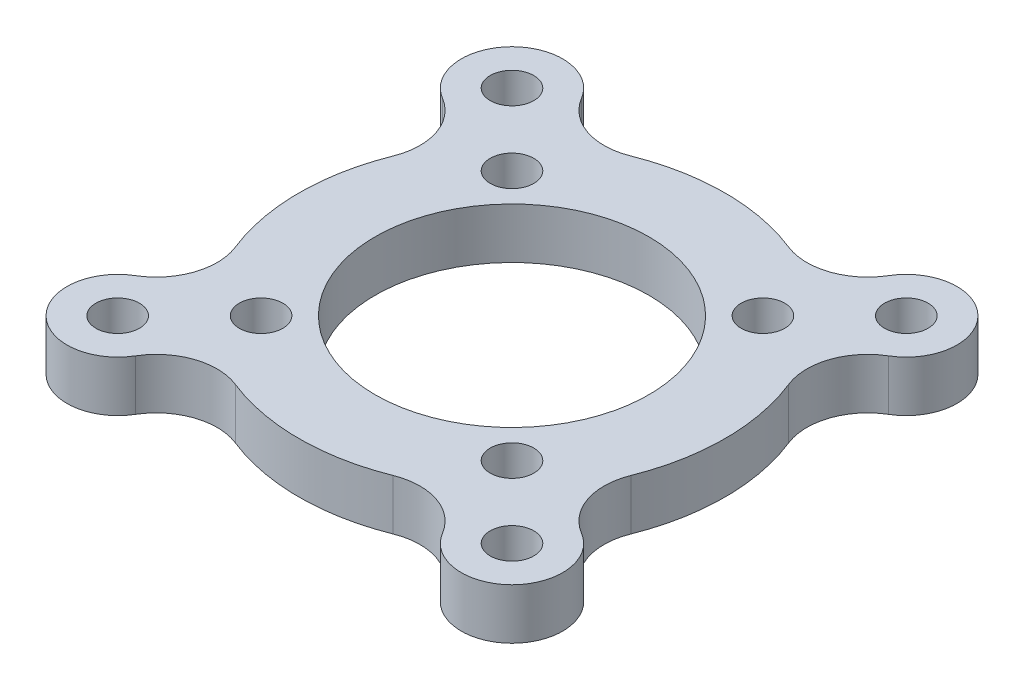
from build123d import *

# Parameters (mm, degrees)
SKETCH_1_R      = 13.5
SKETCH_1_R_2    = 2.15
EXTRUDE_1_DEPTH = 5


with BuildPart() as part:
    # ｽｹｯﾁ1 → ﾎﾞｽ - 押し出し1 (new body)
    with BuildSketch(Plane(origin=(0, 0, 0), x_dir=(1, 0, 0), z_dir=(0, 1, 0))):
        with BuildLine():
            ThreePointArc((19.507056212, -7.776551803), (21, 0), (19.507056212, 7.776551803))
            ThreePointArc((19.507056212, 7.776551803), (19.398069264, 11.924552334), (22.006829374, 15.151339784))
            ThreePointArc((22.006829374, 15.151339784), (22.980970389, 22.980970389), (15.151339784, 22.006829374))
            ThreePointArc((15.151339784, 22.006829374), (11.924552334, 19.398069264), (7.776551803, 19.507056212))
            ThreePointArc((7.776551803, 19.507056212), (0, 21), (-7.776551803, 19.507056212))
            ThreePointArc((-7.776551803, 19.507056212), (-11.924552334, 19.398069264), (-15.151339784, 22.006829374))
            ThreePointArc((-15.151339784, 22.006829374), (-22.980970389, 22.980970389), (-22.006829374, 15.151339784))
            ThreePointArc((-22.006829374, 15.151339784), (-19.398069264, 11.924552334), (-19.507056212, 7.776551803))
            ThreePointArc((-19.507056212, 7.776551803), (-21, 0), (-19.507056212, -7.776551803))
            ThreePointArc((-19.507056212, -7.776551803), (-19.398069264, -11.924552334), (-22.006829374, -15.151339784))
            ThreePointArc((-22.006829374, -15.151339784), (-22.980970389, -22.980970389), (-15.151339784, -22.006829374))
            ThreePointArc((-15.151339784, -22.006829374), (-11.924552334, -19.398069264), (-7.776551803, -19.507056212))
            ThreePointArc((-7.776551803, -19.507056212), (0, -21), (7.776551803, -19.507056212))
            ThreePointArc((7.776551803, -19.507056212), (11.924552334, -19.398069264), (15.151339784, -22.006829374))
            ThreePointArc((15.151339784, -22.006829374), (22.980970389, -22.980970389), (22.006829374, -15.151339784))
            ThreePointArc((22.006829374, -15.151339784), (19.398069264, -11.924552334), (19.507056212, -7.776551803))
        make_face()
        with Locations(Location((0, 0, 0), (0, 0, 270))):
            Circle(SKETCH_1_R, mode=Mode.SUBTRACT)
        with Locations(Location((12.374368671, 12.374368671, 0), (0, 0, 270))):
            Circle(SKETCH_1_R_2, mode=Mode.SUBTRACT)
        with Locations(Location((12.374368671, -12.374368671, 0), (0, 0, 270))):
            Circle(SKETCH_1_R_2, mode=Mode.SUBTRACT)
        with Locations(Location((-12.374368671, -12.374368671, 0), (0, 0, 270))):
            Circle(SKETCH_1_R_2, mode=Mode.SUBTRACT)
        with Locations(Location((-12.374368671, 12.374368671, 0), (0, 0, 270))):
            Circle(SKETCH_1_R_2, mode=Mode.SUBTRACT)
        with Locations(Location((19.445436483, 19.445436483, 0), (0, 0, 270))):
            Circle(SKETCH_1_R_2, mode=Mode.SUBTRACT)
        with Locations(Location((19.445436483, -19.445436483, 0), (0, 0, 270))):
            Circle(SKETCH_1_R_2, mode=Mode.SUBTRACT)
        with Locations(Location((-19.445436483, -19.445436483, 0), (0, 0, 270))):
            Circle(SKETCH_1_R_2, mode=Mode.SUBTRACT)
        with Locations(Location((-19.445436483, 19.445436483, 0), (0, 0, 270))):
            Circle(SKETCH_1_R_2, mode=Mode.SUBTRACT)
    extrude(amount=EXTRUDE_1_DEPTH)


solid = part.part
